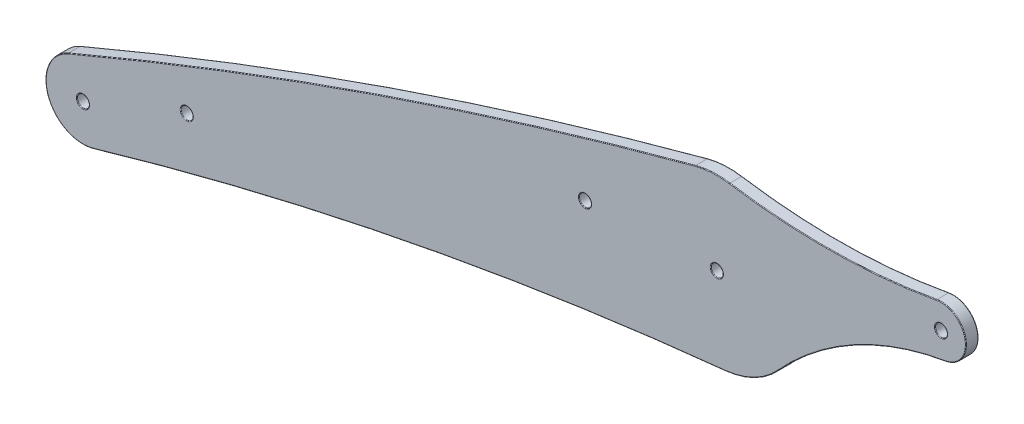
from build123d import *

# Parameters (mm, degrees)
EXTRUDE_1_DEPTH      = 3
HOLE_WIZARD_M3_5_1_D = 2.9
FILLET_1_R           = 0.15


with BuildPart() as part:
    # 草图1 → 凸台-拉伸1 (new body)
    with BuildSketch(Plane.XY):
        with BuildLine():
            ThreePointArc((-223.412781063, 165.183585273), (-148.818107133, 193.832539939), (-72.414055422, 217.232302))
            ThreePointArc((-72.414055422, 217.232302), (-68.309240848, 217.887726777), (-64.157599264, 217.680467302))
            ThreePointArc((-64.157599264, 217.680467302), (-39.2013243, 215.9181933), (-14.299270337, 218.328375477))
            ThreePointArc((-14.299270337, 218.328375477), (-7.315765693, 213.463697885), (-12.22249099, 206.509672284))
            ThreePointArc((-12.22249099, 206.509672284), (-34.165250739, 198.880307204), (-52.40271471, 184.489795578))
            ThreePointArc((-52.40271471, 184.489795578), (-58.19845217, 180.070070577), (-65.193047538, 178.020637133))
            ThreePointArc((-65.193047538, 178.020637133), (-141.961707775, 166.618041896), (-217.3703097, 148.260778255))
            ThreePointArc((-217.3703097, 148.260778255), (-228.371975575, 153.872682809), (-223.412781063, 165.183585273))
        make_face()
    extrude(amount=-EXTRUDE_1_DEPTH)

    # M3.5 螺纹孔的螺纹孔钻头1 (through all)
    with Locations(Plane.XY):
        with Locations((-219.896078152, 156.899093699), (-194.896078152, 166.921661009), (-98.975224859, 196.660053295), (-67.225224859, 197.917125651), (-13.225224859, 212.425289309)):
            Hole(HOLE_WIZARD_M3_5_1_D / 2)

    # 圆角1
    fillet_1_edges = [part.edges().sort_by_distance(p)[0] for p in [
        (-34.165250739, 198.880307204, 0),
        (-58.19845217, 180.070070577, 0),
        (-141.961707775, 166.618041896, 0),
        (-228.371975575, 153.872682809, 0),
        (-58.19845217, 180.070070577, -3),
        (-34.165250739, 198.880307204, -3),
        (-7.315765693, 213.463697885, -3),
        (-39.2013243, 215.9181933, -3),
        (-11.775224859, 212.425289309, 0),
        (-11.775224859, 212.425289309, -3),
        (-68.309240848, 217.887726777, -3),
        (-148.818107133, 193.832539939, -3),
        (-65.775224859, 197.917125651, 0),
        (-65.775224859, 197.917125651, -3),
        (-97.525224859, 196.660053295, 0),
        (-97.525224859, 196.660053295, -3),
        (-193.446078152, 166.921661009, 0),
        (-193.446078152, 166.921661009, -3),
        (-218.446078152, 156.899093699, 0),
        (-218.446078152, 156.899093699, -3),
        (-228.371975575, 153.872682809, -3),
        (-148.818107133, 193.832539939, 0),
        (-141.961707775, 166.618041896, -3),
        (-68.309240848, 217.887726777, 0),
        (-39.2013243, 215.9181933, 0),
        (-7.315765693, 213.463697885, 0),
    ]]
    fillet(fillet_1_edges, radius=FILLET_1_R)


solid = part.part
